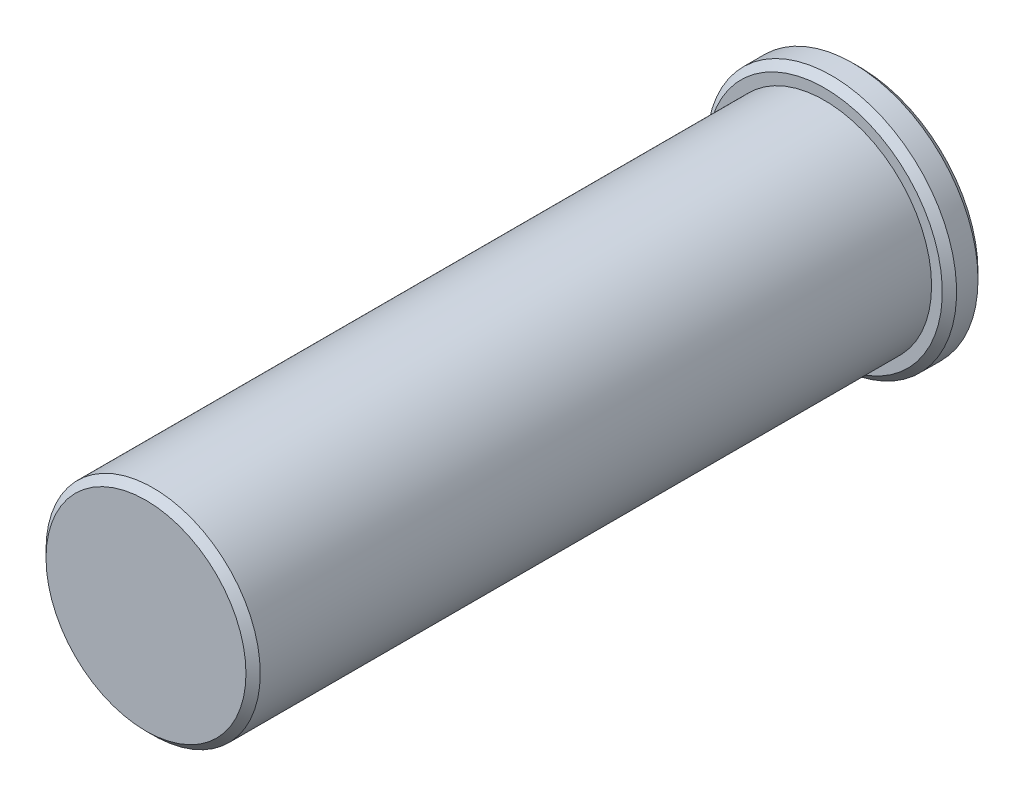
from build123d import *

# Parameters (mm, degrees)
SKETCH_1_R          = 1.5
EXTRUDE_1_DEPTH     = 10
SKETCH_2_R          = 1.75
EXTRUDE_2_DEPTH     = 0.5
CHAMFER_1_SIZE      = 0.1
SKETCH_3_R          = 1
CUT_EXTRUDE_1_DEPTH = 5


with BuildPart() as part:
    # 草图1 → 凸台-拉伸1 (new body)
    with BuildSketch(Plane.XY):
        Circle(SKETCH_1_R)
    extrude(amount=EXTRUDE_1_DEPTH)

    # 草图2 → 凸台-拉伸2 (add)
    with BuildSketch(Plane(origin=(0, 0, 0), x_dir=(-1, 0, 0), z_dir=(0, 0, -1))):
        Circle(SKETCH_2_R)
    extrude(amount=-EXTRUDE_2_DEPTH)

    # 倒角1
    chamfer_1_edges = [part.edges().sort_by_distance(p)[0] for p in [
        (-1.5, 0, 10),
        (1.75, 0, 0.5),
        (1.75, 0, 0),
    ]]
    chamfer(chamfer_1_edges, length=CHAMFER_1_SIZE)

    # 草图3 → 切除-拉伸1 (cut)
    with BuildSketch(Plane(origin=(0, 0, 0), x_dir=(-1, 0, 0), z_dir=(0, 0, -1))):
        Circle(SKETCH_3_R)
    extrude(amount=-CUT_EXTRUDE_1_DEPTH, mode=Mode.SUBTRACT)


solid = part.part
